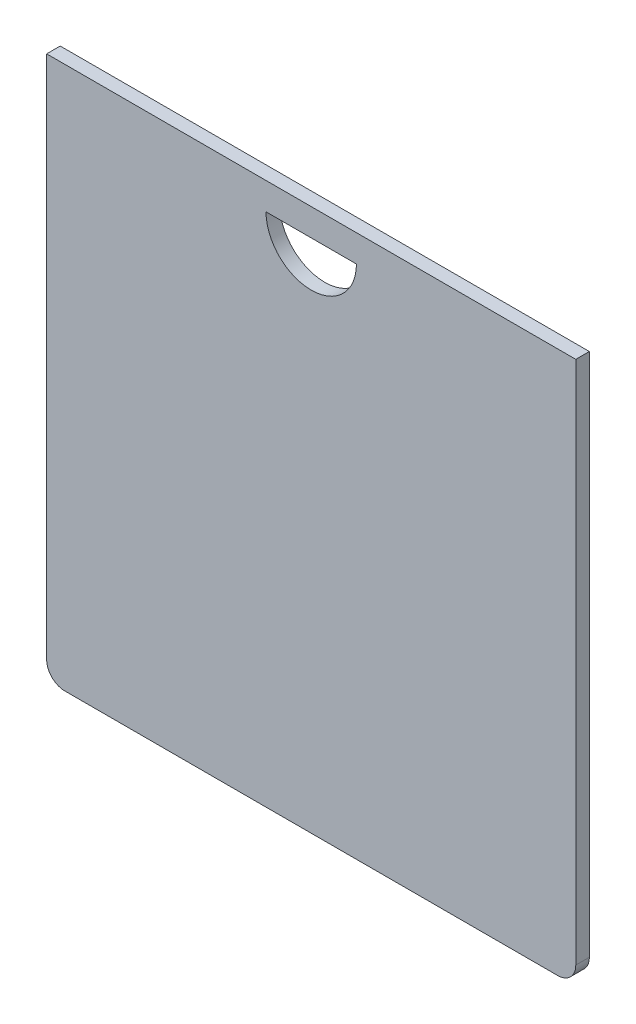
from build123d import *

# Parameters (mm, degrees)
SKETCH_1_W          = 58.5
SKETCH_1_H          = 60
EXTRUDE_1_DEPTH     = 1.5
FILLET_1_R          = 2
CUT_EXTRUDE_1_DEPTH = 84.812290268


with BuildPart() as part:
    # Эскиз1 → Бобышка-Вытянуть1 (new body)
    with BuildSketch(Plane.XY):
        with Locations((29.25, 30)):
            Rectangle(SKETCH_1_W, SKETCH_1_H)
    extrude(amount=EXTRUDE_1_DEPTH)

    # Скругление1
    fillet_1_edges = [part.edges().sort_by_distance(p)[0] for p in [
        (58.5, 0, 0.75),
        (0, 0, 0.75),
    ]]
    fillet(fillet_1_edges, radius=FILLET_1_R)

    # Эскиз2 → Вырез-Вытянуть1 (cut, through all)
    with BuildSketch(Plane.XY.offset(1.5)):
        with BuildLine():
            Line((24.25, 57), (34.25, 57))
            ThreePointArc((34.25, 57), (29.25, 52), (24.25, 57))
        make_face()
    extrude(amount=-CUT_EXTRUDE_1_DEPTH, mode=Mode.SUBTRACT)


solid = part.part
